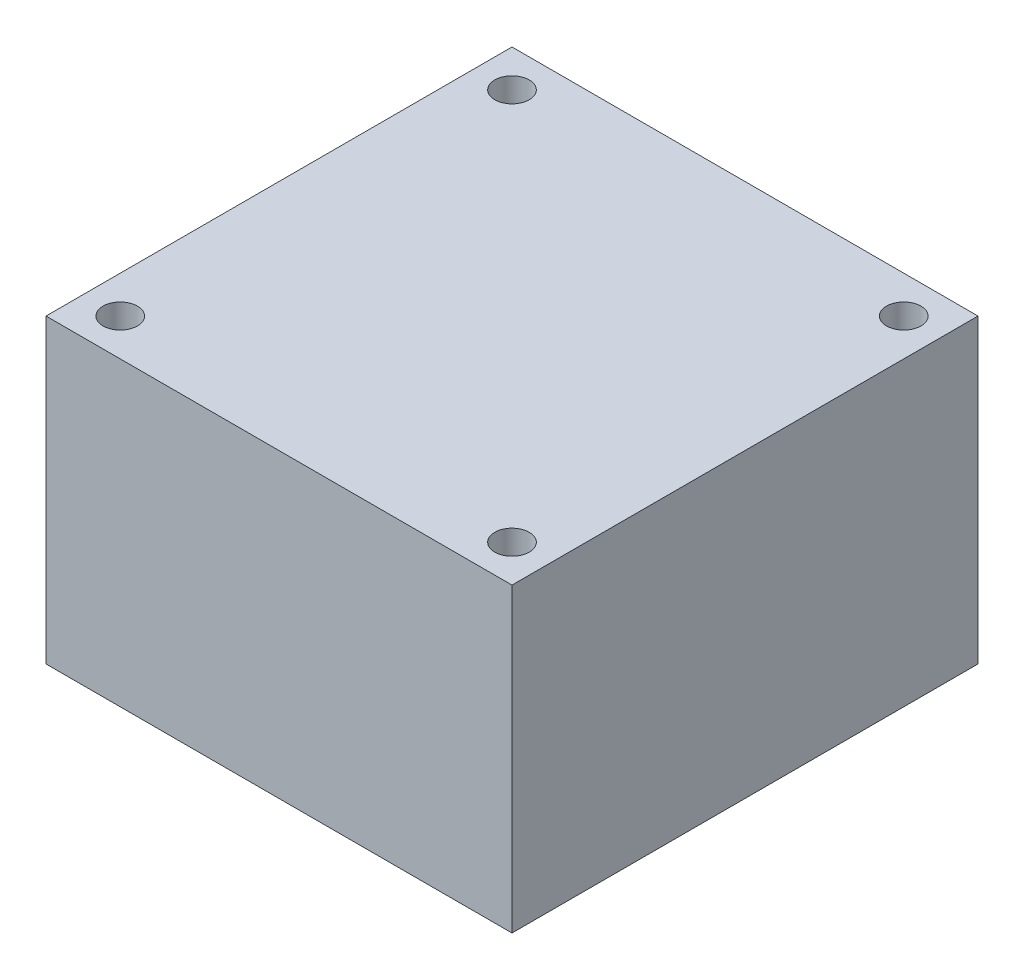
from build123d import *

# Parameters (mm, degrees)
SKETCH_1_W      = 43.3
SKETCH_1_H      = 43.3
SKETCH_1_R      = 1.6
EXTRUDE_1_DEPTH = 28


with BuildPart() as part:
    # 草图1 → 凸台-拉伸1 (new body)
    with BuildSketch(Plane(origin=(0, 0, 0), x_dir=(1, 0, 0), z_dir=(0, 1, 0))):
        Rectangle(SKETCH_1_W, SKETCH_1_H)
        with Locations(Location((18.2, 18.2, 0), (0, 0, 270))):
            Circle(SKETCH_1_R, mode=Mode.SUBTRACT)
        with Locations(Location((-18.2, 18.2, 0), (0, 0, 90))):
            Circle(SKETCH_1_R, mode=Mode.SUBTRACT)
        with Locations(Location((18.2, -18.2, 0), (0, 0, 90))):
            Circle(SKETCH_1_R, mode=Mode.SUBTRACT)
        with Locations(Location((-18.2, -18.2, 0), (0, 0, 270))):
            Circle(SKETCH_1_R, mode=Mode.SUBTRACT)
    extrude(amount=EXTRUDE_1_DEPTH)


solid = part.part
